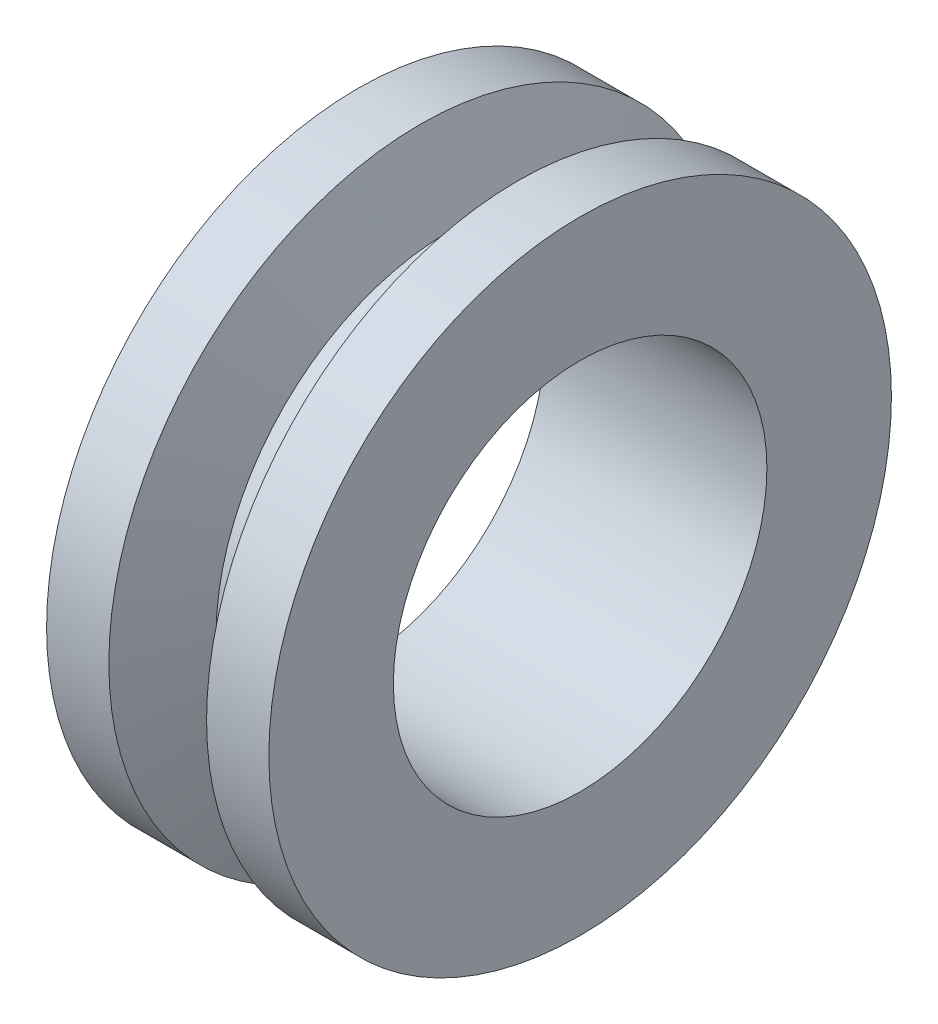
from build123d import *


with BuildPart() as part:
    # Sketch2 → Revolve1 (revolve)
    with BuildSketch(Plane.XY):
        Polygon((27.16373057, 24), (-1.396891192, 24), (-1.396891192, 40), (6.603108808, 40), (10.383419689, 30), (15.383419689, 30), (19.16373057, 40), (27.16373057, 40), align=None)
    revolve(axis=Axis((0, 0, 0), (-1, 0, 0)))


solid = part.part
